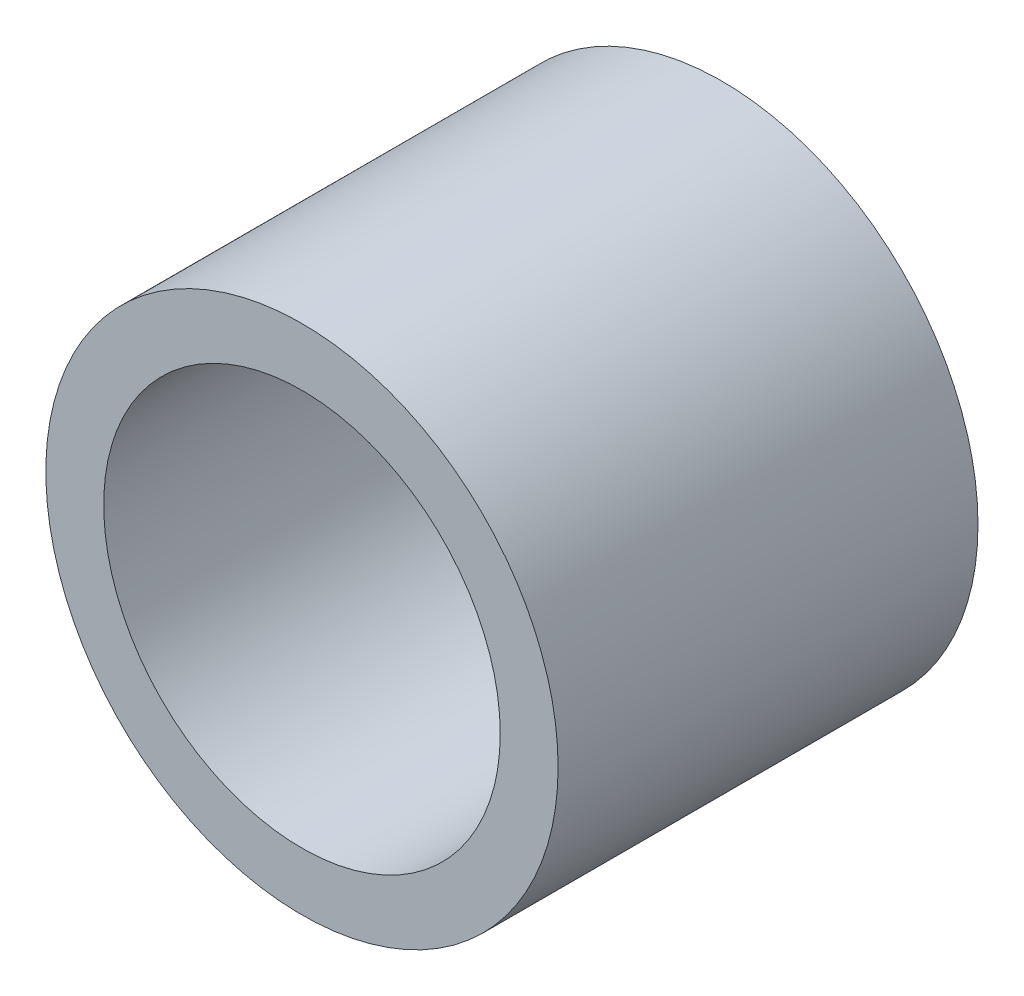
from build123d import *

# Parameters (mm, degrees)
SKETCH1_W = 2.48
SKETCH1_H = 18


with BuildPart() as part:
    # Sketch1 → Revolve1 (revolve)
    with BuildSketch(Plane(origin=(0, 0, 0), x_dir=(1, 0, 0), z_dir=(0, 1, 0)), mode=Mode.PRIVATE) as revolve1_sk:
        with Locations((-9.74, 9)):
            Rectangle(SKETCH1_W, SKETCH1_H)
    revolve(revolve1_sk.sketch.rotate(Axis((0, 0, 0), (0, 0, -1)), 180), axis=Axis((0, 0, 0), (0, 0, -1)))


solid = part.part
